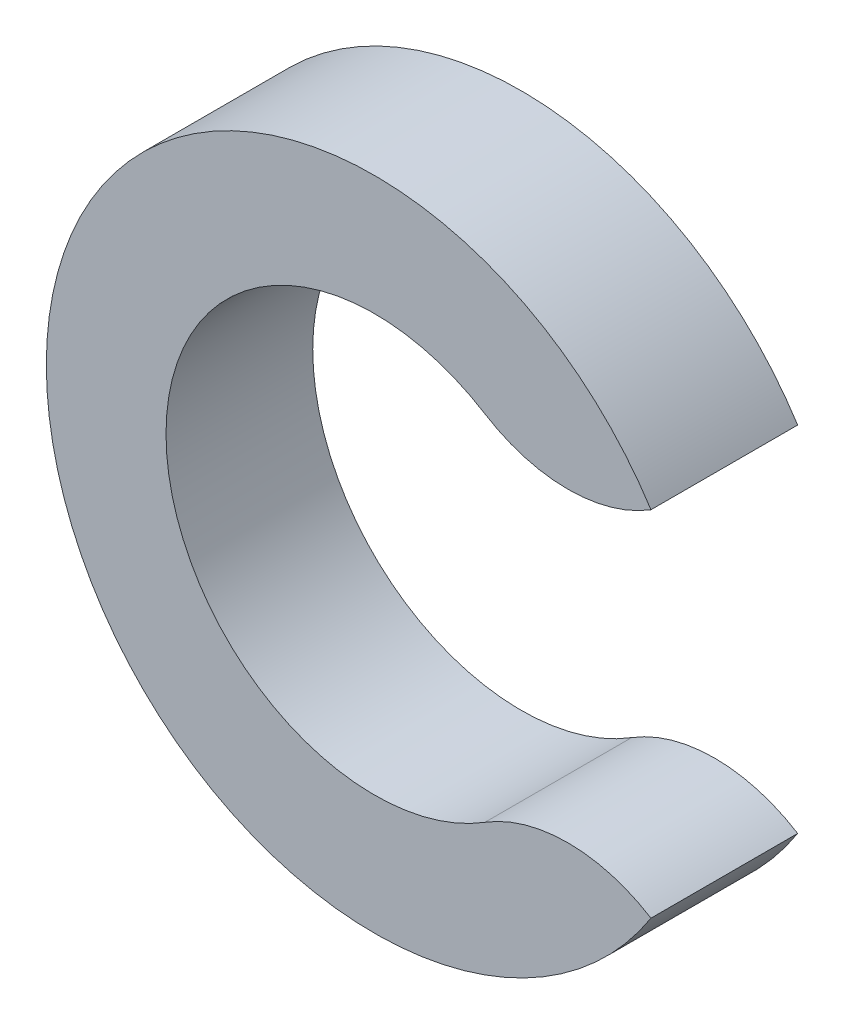
from build123d import *

# Parameters (mm, degrees)
BOSS_EXTRUDE1_DEPTH = 1.9


with BuildPart() as part:
    # Sketch1 → Boss-Extrude1 (new body)
    with BuildSketch(Plane.XY):
        with BuildLine():
            ThreePointArc((1.429937387, -2.290257424), (-2.7, 0), (1.429937387, 2.290257424))
            ThreePointArc((1.429937387, 2.290257424), (2.50502602, 1.982195274), (3.580114653, 2.290257424))
            ThreePointArc((3.580114653, 2.290257424), (-4.25, 0), (3.580114653, -2.290257424))
            ThreePointArc((3.580114653, -2.290257424), (2.50502602, -1.982195274), (1.429937387, -2.290257424))
        make_face()
    extrude(amount=BOSS_EXTRUDE1_DEPTH)


solid = part.part
